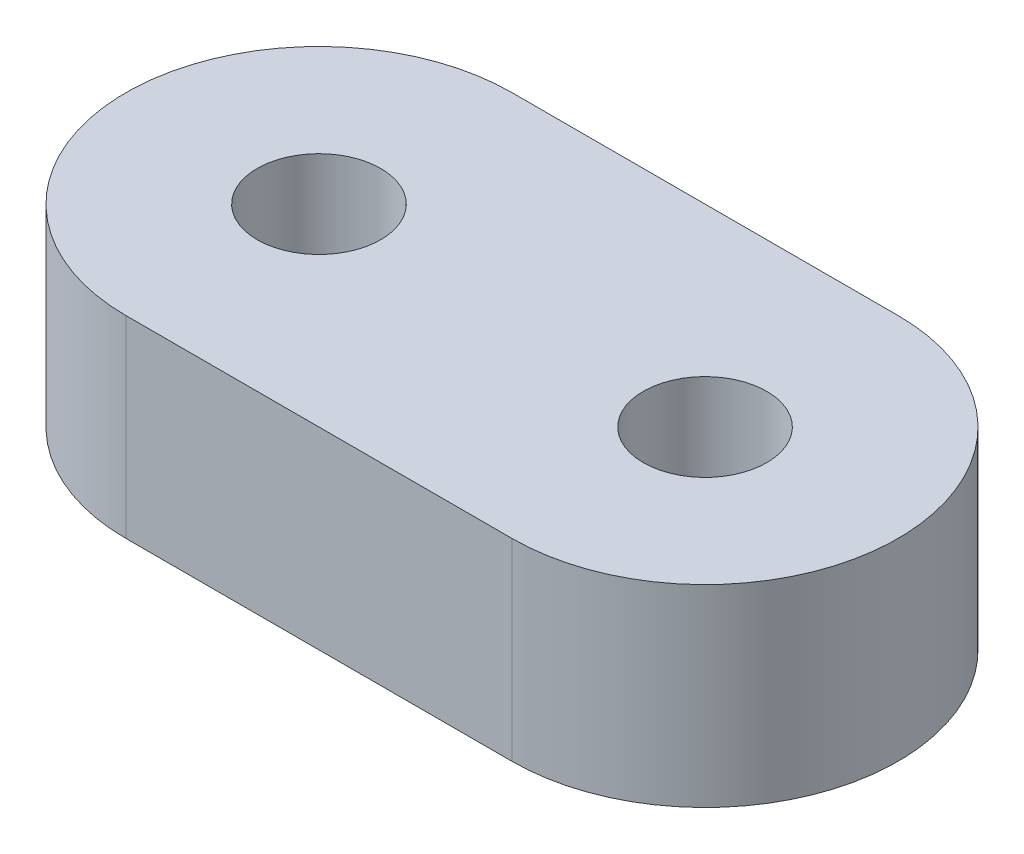
from build123d import *

# Parameters (mm, degrees)
SKETCH1_R           = 1.6
BOSS_EXTRUDE1_DEPTH = 2.5


with BuildPart() as part:
    # Sketch1 → Boss-Extrude1 (new, symmetric)
    with BuildSketch(Plane(origin=(0, 0, 0), x_dir=(1, 0, 0), z_dir=(0, 1, 0))):
        with BuildLine():
            Line((5, -5), (-5, -5))
            ThreePointArc((-5, -5), (-10, 0), (-5, 5))
            Line((-5, 5), (5, 5))
            ThreePointArc((5, 5), (10, 0), (5, -5))
        make_face()
        with Locations(Location((-5, 0, 0), (0, 0, 270))):
            Circle(SKETCH1_R, mode=Mode.SUBTRACT)
        with Locations(Location((5, 0, 0), (0, 0, 270))):
            Circle(SKETCH1_R, mode=Mode.SUBTRACT)
    extrude(amount=BOSS_EXTRUDE1_DEPTH, both=True)


solid = part.part
